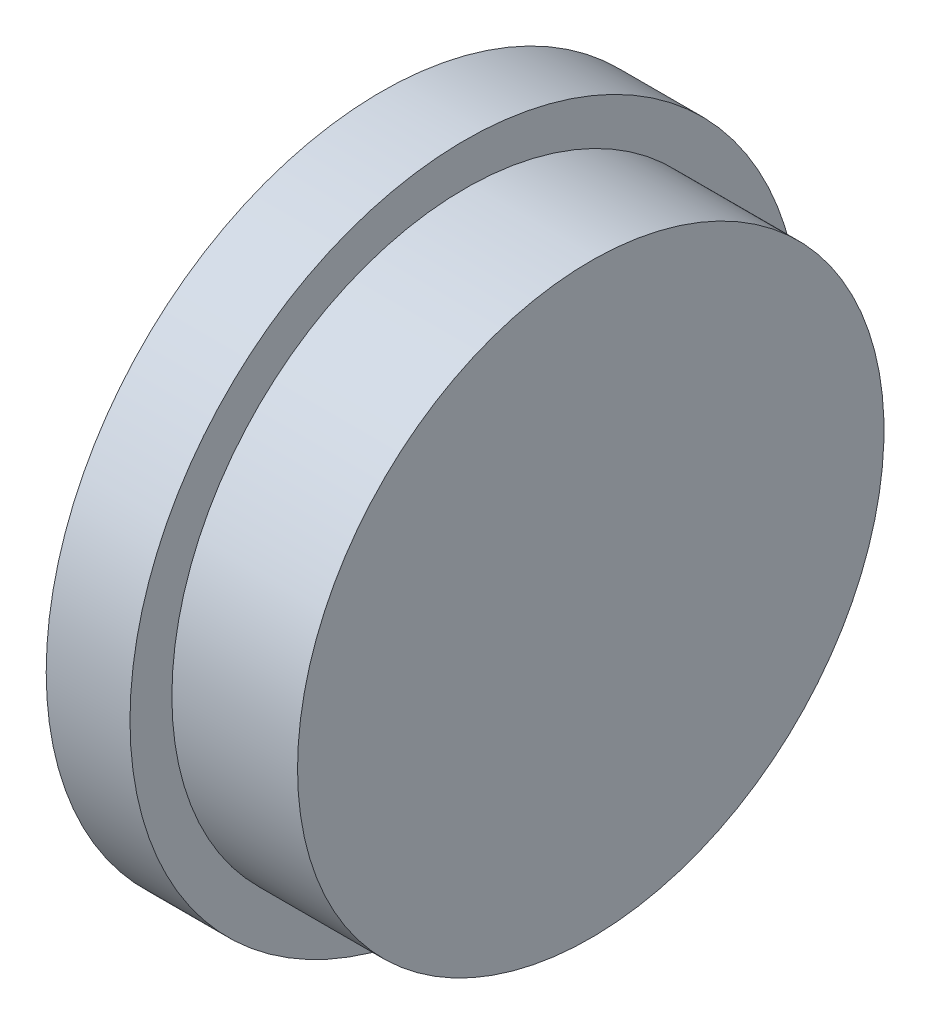
from build123d import *


with BuildPart() as part:
    # Esquisse6 → Révolution1 (revolve)
    with BuildSketch(Plane.XY, mode=Mode.PRIVATE) as r_volution1_sk:
        Polygon((15, 0), (13, 0), (13, 16), (0, 16), (0, 24), (6, 24), (6, 21), (15, 21), align=None)
    revolve(r_volution1_sk.sketch.rotate(Axis((0, 0, 0), (1, 0, 0)), 90), axis=Axis((0, 0, 0), (1, 0, 0)))


solid = part.part
